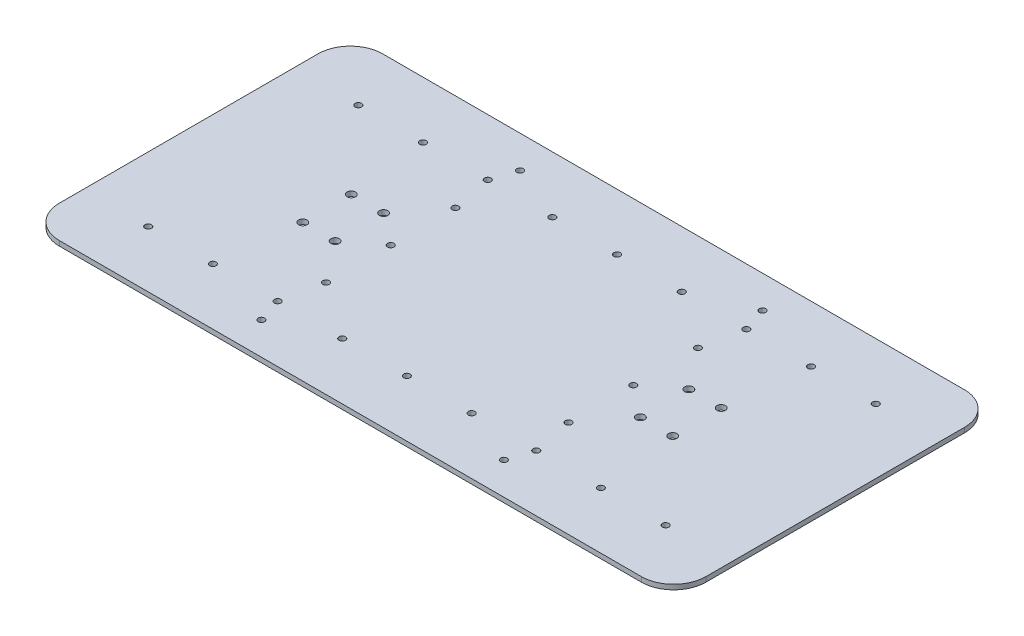
from build123d import *

# Parameters (mm, degrees)
EXTRUDE_2_DEPTH           = 3
CUT_EXTRUDE_3_DEPTH       = 10
CUT_EXTRUDE_3_DEPTH_BACK  = 224.626921456
SKETCH_2_R                = 2.6
SKETCH_3_R                = 2.6
CUT_EXTRUDE_4_DEPTH       = 3
CUT_EXTRUDE_29_DEPTH      = 10
CUT_EXTRUDE_29_DEPTH_BACK = 3
SKETCH_4_R                = 2
SKETCH_5_R                = 2
CUT_EXTRUDE_30_DEPTH      = 3
SKETCH_6_R                = 2
CUT_EXTRUDE_31_DEPTH      = 3
SKETCH_7_R                = 2
CUT_EXTRUDE_32_DEPTH      = 3
SKETCH_8_R                = 2
CUT_EXTRUDE_33_DEPTH      = 3
SKETCH_9_R                = 2
CUT_EXTRUDE_34_DEPTH      = 3


with BuildPart() as part:
    # 草图1 → 凸台-拉伸2 (new body)
    with BuildSketch(Plane(origin=(0, 0, 0), x_dir=(1, 0, 0), z_dir=(0, 1, 0))):
        with BuildLine():
            Line((180, -100), (-180, -100))
            ThreePointArc((-180, -100), (-194.142135624, -94.142135624), (-200, -80))
            Line((-200, -80), (-200, 80))
            ThreePointArc((-200, 80), (-194.142135624, 94.142135624), (-180, 100))
            Line((-180, 100), (180, 100))
            ThreePointArc((180, 100), (194.142135624, 94.142135624), (200, 80))
            Line((200, 80), (200, -80))
            ThreePointArc((200, -80), (194.142135624, -94.142135624), (180, -100))
        make_face()
    extrude(amount=EXTRUDE_2_DEPTH)

    # 草图2 → 切除-拉伸3 (cut, two sides: drawn at the far end of the back side and taken through both)
    with BuildSketch(Plane(origin=(0, 0, 0), x_dir=(1, 0, 0), z_dir=(0, 1, 0)).offset(-CUT_EXTRUDE_3_DEPTH_BACK)):
        with Locations(Location((-114.4, 15, 0), (0, 0, 270))):
            Circle(SKETCH_2_R)
    extrude(amount=CUT_EXTRUDE_3_DEPTH + CUT_EXTRUDE_3_DEPTH_BACK, mode=Mode.SUBTRACT)

    # 草图3 → 切除-拉伸4 (cut)
    with BuildSketch(Plane(origin=(0, 3, 0), x_dir=(1, 0, 0), z_dir=(0, 1, 0))):
        with Locations(Location((-114.4, -15, 0), (0, 0, 270))):
            Circle(SKETCH_3_R)
        with Locations(Location((-94.4, 15, 0), (0, 0, 270))):
            Circle(SKETCH_3_R)
        with Locations(Location((-94.4, -15, 0), (0, 0, 270))):
            Circle(SKETCH_3_R)
        with Locations(Location((114.4, 15, 0), (0, 0, 270))):
            Circle(SKETCH_3_R)
        with Locations(Location((94.4, 15, 0), (0, 0, 270))):
            Circle(SKETCH_3_R)
        with Locations(Location((94.4, -15, 0), (0, 0, 270))):
            Circle(SKETCH_3_R)
        with Locations(Location((114.4, -15, 0), (0, 0, 270))):
            Circle(SKETCH_3_R)
    extrude(amount=-CUT_EXTRUDE_4_DEPTH, mode=Mode.SUBTRACT)

    # 草图4 → 切除-拉伸29 (cut, two sides: drawn at the far end of the back side and taken through both)
    with BuildSketch(Plane(origin=(0, 0, 0), x_dir=(1, 0, 0), z_dir=(0, 1, 0)).offset(-CUT_EXTRUDE_29_DEPTH_BACK)):
        with Locations(Location((160, 65, 0), (0, 0, 270))):
            Circle(SKETCH_4_R)
    extrude(amount=CUT_EXTRUDE_29_DEPTH + CUT_EXTRUDE_29_DEPTH_BACK, mode=Mode.SUBTRACT)

    # 草图5 → 切除-拉伸30 (cut)
    with BuildSketch(Plane(origin=(0, 3, 0), x_dir=(1, 0, 0), z_dir=(0, 1, 0))):
        with Locations(Location((-160, -65, 0), (0, 0, 270))):
            Circle(SKETCH_5_R)
        with Locations(Location((-120, -65, 0), (0, 0, 270))):
            Circle(SKETCH_5_R)
        with Locations(Location((-80, -65, 0), (0, 0, 270))):
            Circle(SKETCH_5_R)
        with Locations(Location((-40, -65, 0), (0, 0, 270))):
            Circle(SKETCH_5_R)
        with Locations(Location((0, -65, 0), (0, 0, 270))):
            Circle(SKETCH_5_R)
        with Locations(Location((40, -65, 0), (0, 0, 270))):
            Circle(SKETCH_5_R)
        with Locations(Location((80, -65, 0), (0, 0, 270))):
            Circle(SKETCH_5_R)
        with Locations(Location((120, -65, 0), (0, 0, 270))):
            Circle(SKETCH_5_R)
        with Locations(Location((160, -65, 0), (0, 0, 270))):
            Circle(SKETCH_5_R)
    extrude(amount=-CUT_EXTRUDE_30_DEPTH, mode=Mode.SUBTRACT)

    # 草图6 → 切除-拉伸31 (cut)
    with BuildSketch(Plane(origin=(0, 3, 0), x_dir=(1, 0, 0), z_dir=(0, 1, 0))):
        with Locations(Location((-160, 65, 0), (0, 0, 270))):
            Circle(SKETCH_6_R)
        with Locations(Location((-120, 65, 0), (0, 0, 270))):
            Circle(SKETCH_6_R)
        with Locations(Location((-80, 65, 0), (0, 0, 270))):
            Circle(SKETCH_6_R)
        with Locations(Location((-40, 65, 0), (0, 0, 270))):
            Circle(SKETCH_6_R)
        with Locations(Location((0, 65, 0), (0, 0, 270))):
            Circle(SKETCH_6_R)
        with Locations(Location((40, 65, 0), (0, 0, 270))):
            Circle(SKETCH_6_R)
        with Locations(Location((80, 65, 0), (0, 0, 270))):
            Circle(SKETCH_6_R)
        with Locations(Location((120, 65, 0), (0, 0, 270))):
            Circle(SKETCH_6_R)
    extrude(amount=-CUT_EXTRUDE_31_DEPTH, mode=Mode.SUBTRACT)

    # 草图7 → 切除-拉伸32 (cut)
    with BuildSketch(Plane(origin=(0, 3, 0), x_dir=(1, 0, 0), z_dir=(0, 1, 0))):
        with Locations(Location((-75, -80, 0), (0, 0, 270))):
            Circle(SKETCH_7_R)
    extrude(amount=-CUT_EXTRUDE_32_DEPTH, mode=Mode.SUBTRACT)

    # 草图8 → 切除-拉伸33 (cut)
    with BuildSketch(Plane(origin=(0, 3, 0), x_dir=(1, 0, 0), z_dir=(0, 1, 0))):
        with Locations(Location((-75, 80, 0), (0, 0, 270))):
            Circle(SKETCH_8_R)
        with Locations(Location((-75, 40, 0), (0, 0, 270))):
            Circle(SKETCH_8_R)
        with Locations(Location((-75, 0, 0), (0, 0, 270))):
            Circle(SKETCH_8_R)
        with Locations(Location((-75, -40, 0), (0, 0, 270))):
            Circle(SKETCH_8_R)
    extrude(amount=-CUT_EXTRUDE_33_DEPTH, mode=Mode.SUBTRACT)

    # 草图9 → 切除-拉伸34 (cut)
    with BuildSketch(Plane(origin=(0, 3, 0), x_dir=(1, 0, 0), z_dir=(0, 1, 0))):
        with Locations(Location((75, 80, 0), (0, 0, 270))):
            Circle(SKETCH_9_R)
        with Locations(Location((75, 40, 0), (0, 0, 270))):
            Circle(SKETCH_9_R)
        with Locations(Location((75, 0, 0), (0, 0, 270))):
            Circle(SKETCH_9_R)
        with Locations(Location((75, -40, 0), (0, 0, 270))):
            Circle(SKETCH_9_R)
        with Locations(Location((75, -80, 0), (0, 0, 270))):
            Circle(SKETCH_9_R)
    extrude(amount=-CUT_EXTRUDE_34_DEPTH, mode=Mode.SUBTRACT)


solid = part.part
